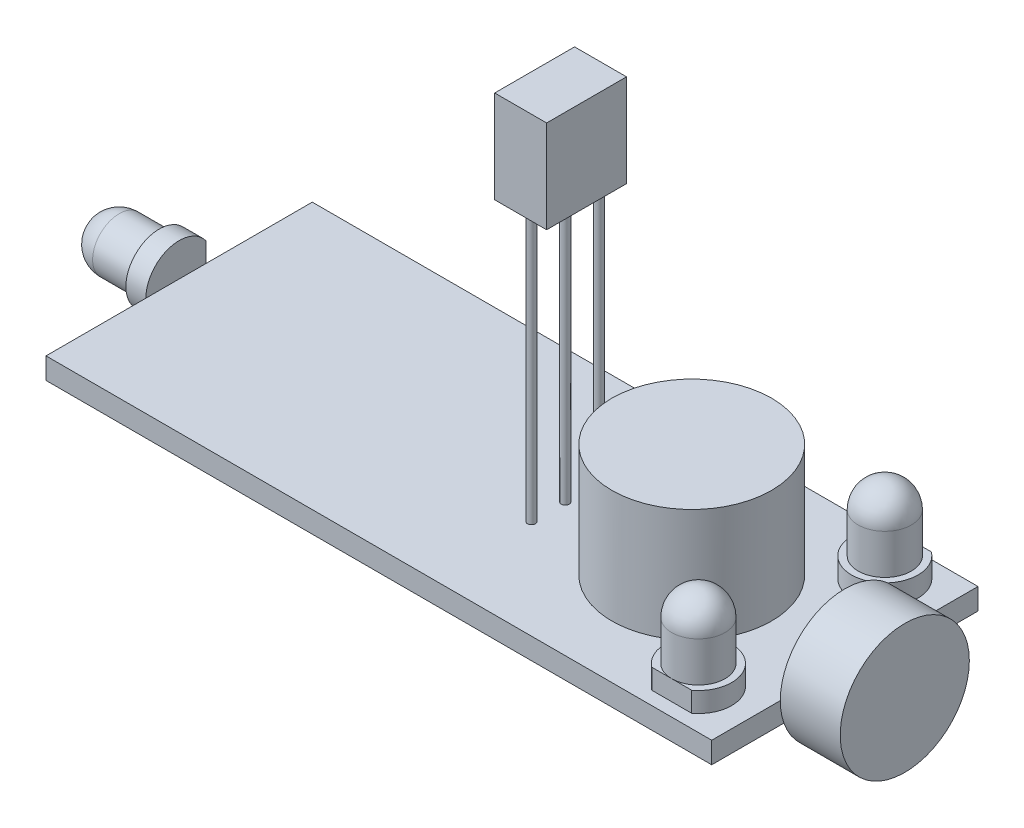
from build123d import *

# Parameters (mm, degrees)
SKETCH1_W           = 50
SKETCH1_H           = 20
BOSS_EXTRUDE1_DEPTH = 1.6
SKETCH2_R           = 0.3
BOSS_EXTRUDE2_DEPTH = 20
SKETCH3_W           = 3.9
SKETCH3_H           = 6
BOSS_EXTRUDE3_DEPTH = 6.95
SKETCH6_R           = 6
BOSS_EXTRUDE4_DEPTH = 8.5
SKETCH7_R           = 4.85
BOSS_EXTRUDE5_DEPTH = 4.5
SKETCH8_R           = 2.5
BOSS_EXTRUDE6_DEPTH = 1.5
CUT_EXTRUDE1_REACH  = 66.004
BOSS_EXTRUDE7_DEPTH = 1.5


with BuildPart() as part:
    # Sketch1 → Boss-Extrude1 (new body)
    with BuildSketch(Plane(origin=(0, 0, 0), x_dir=(1, 0, 0), z_dir=(0, 1, 0))):
        with Locations((25, 10)):
            Rectangle(SKETCH1_W, SKETCH1_H)
    extrude(amount=BOSS_EXTRUDE1_DEPTH)

    # Sketch2 → Boss-Extrude2 (add)
    with BuildSketch(Plane(origin=(0, 1.6, 0), x_dir=(1, 0, 0), z_dir=(0, 1, 0))):
        with Locations(Location((29, 12.54, 0), (0, 0, 90))):
            Circle(SKETCH2_R)
        with Locations(Location((29, 10, 0), (0, 0, 90))):
            Circle(SKETCH2_R)
        with Locations(Location((29, 7.46, 0), (0, 0, 90))):
            Circle(SKETCH2_R)
    extrude(amount=BOSS_EXTRUDE2_DEPTH)

    # Sketch3 → Boss-Extrude3 (add)
    with BuildSketch(Plane(origin=(0, 21.6, 0), x_dir=(1, 0, 0), z_dir=(0, 1, 0))):
        with Locations((28.65, 10)):
            Rectangle(SKETCH3_W, SKETCH3_H)
    extrude(amount=BOSS_EXTRUDE3_DEPTH)

    # Sketch5 → Revolve1 (revolve)
    with BuildSketch(Plane(origin=(0, 25.85, 0), x_dir=(1, 0, 0), z_dir=(0, 1, 0))):
        with BuildLine():
            Line((26.7, 10), (26.7, 12.5))
            ThreePointArc((26.7, 12.5), (25.786983735, 11.395327736), (25.459936306, 10))
            Line((25.459936306, 10), (26.7, 10))
        make_face()
    revolve(axis=Axis((25.459936306, 25.85, -10), (1, 0, 0)))

    # Sketch6 → Boss-Extrude4 (add)
    with BuildSketch(Plane(origin=(0, 1.6, 0), x_dir=(1, 0, 0), z_dir=(0, 1, 0))):
        with Locations(Location((38.5, 10, 0), (0, 0, 90))):
            Circle(SKETCH6_R)
    extrude(amount=BOSS_EXTRUDE4_DEPTH)

    # Sketch7 → Boss-Extrude5 (add)
    with BuildSketch(Plane(origin=(50, 0, 0), x_dir=(0, 0, -1), z_dir=(1, 0, 0))):
        with Locations((10, 1.6)):
            Circle(SKETCH7_R)
    extrude(amount=BOSS_EXTRUDE5_DEPTH)

    # Sketch8 → Boss-Extrude6 (add)
    with BuildSketch(Plane(origin=(0, 1.6, 0), x_dir=(1, 0, 0), z_dir=(0, 1, 0))):
        with Locations(Location((46, 17, 0), (0, 0, 90))):
            Circle(SKETCH8_R)
    boss_extrude6 = extrude(amount=BOSS_EXTRUDE6_DEPTH)

    # Sketch10 → Revolve2 (revolve)
    with BuildSketch(Plane(origin=(46, 0, 0), x_dir=(0, 0, -1), z_dir=(1, 0, 0))):
        with BuildLine():
            Line((19, 3.1), (19, 6.1))
            ThreePointArc((19, 6.1), (18.414213562, 7.514213562), (17, 8.1))
            Line((17, 8.1), (17, 3.1))
            Line((17, 3.1), (19, 3.1))
        make_face()
    revolve2 = revolve(axis=Axis((46, 3.1, -17), (0, 1, 0)))

    # Sketch11 → Cut-Extrude1 (cut, up to next)
    with BuildSketch(Plane(origin=(0, 1.6, 0), x_dir=(1, 0, 0), z_dir=(0, 1, 0)), mode=Mode.PRIVATE) as cut_extrude1_sk1:
        with BuildLine():
            Line((44.5, 19), (47.5, 19))
            ThreePointArc((47.5, 19), (46, 19.5), (44.5, 19))
        make_face()
    cut_extrude1_tool1 = extrude(cut_extrude1_sk1.sketch, amount=CUT_EXTRUDE1_REACH, mode=Mode.PRIVATE) & part.part
    cut_extrude1 = cut_extrude1_tool1.solids().sort_by_distance((46, 1.6, -19.20182))[0]
    add(cut_extrude1, mode=Mode.SUBTRACT)

    # Mirror1: Boss-Extrude6, Revolve2, Cut-Extrude1 across plane
    add(boss_extrude6.mirror(Plane.XY.offset(-10)))
    add(revolve2.mirror(Plane.XY.offset(-10)))
    add(cut_extrude1.mirror(Plane.XY.offset(-10)), mode=Mode.SUBTRACT)

    # Sketch12 → Boss-Extrude7 (add)
    with BuildSketch(Plane.ZY):
        with BuildLine():
            ThreePointArc((-7.5, 1.6), (-9.209430585, 3.971708245), (-12, 3.1))
            Line((-12, 3.1), (-12, 0.1))
            ThreePointArc((-12, 0.1), (-9.209430585, -0.771708245), (-7.5, 1.6))
        make_face()
    extrude(amount=BOSS_EXTRUDE7_DEPTH)

    # Sketch14 → Revolve3 (revolve)
    with BuildSketch(Plane.XY.offset(-10), mode=Mode.PRIVATE) as revolve3_sk:
        with BuildLine():
            Line((-1.5, 3.6), (-4.5, 3.6))
            ThreePointArc((-4.5, 3.6), (-5.914213562, 3.014213562), (-6.5, 1.6))
            Line((-6.5, 1.6), (-1.5, 1.6))
            Line((-1.5, 1.6), (-1.5, 3.6))
        make_face()
    revolve(revolve3_sk.sketch.rotate(Axis((-6.5, 1.6, -10), (1, 0, 0)), 180), axis=Axis((-6.5, 1.6, -10), (1, 0, 0)))


solid = part.part
